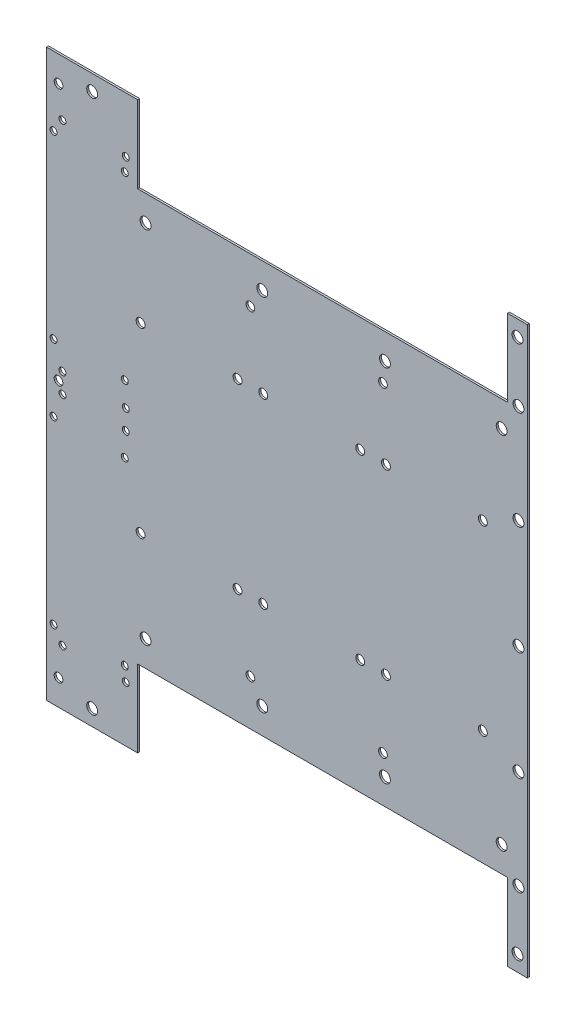
from build123d import *

# Parameters (mm, degrees)
FLOOR_MOUNT_AND_JOINT_HOLES_PROFILE_R   = 2.75
FLOOR_MOUNT_AND_JOINT_HOLES_PROFILE_R_2 = 1.75
FLOOR_MOUNT_AND_JOINT_HOLES_PROFILE_R_3 = 2.25
FLOOR_MOUNT_AND_JOINT_HOLES_PROFILE_R_4 = 2.2
FLOOR_MOUNT_AND_JOINT_HOLES_DEPTH       = 1


with BuildPart() as part:
    # Floor, mount and joint holes profile → Floor, mount and joint holes (new body)
    with BuildSketch(Plane.XY):
        Polygon((-140, -143), (-94, -143), (-94, -104), (93, -104), (93, -143), (103, -143), (103, 143), (93, 143), (93, 104), (-94, 104), (-94, 143), (-140, 143), align=None)
        with Locations((-90, -91)):
            Circle(FLOOR_MOUNT_AND_JOINT_HOLES_PROFILE_R, mode=Mode.SUBTRACT)
        with Locations((-90, 91)):
            Circle(FLOOR_MOUNT_AND_JOINT_HOLES_PROFILE_R, mode=Mode.SUBTRACT)
        with Locations((-31, -91)):
            Circle(FLOOR_MOUNT_AND_JOINT_HOLES_PROFILE_R, mode=Mode.SUBTRACT)
        with Locations((-31, 91)):
            Circle(FLOOR_MOUNT_AND_JOINT_HOLES_PROFILE_R, mode=Mode.SUBTRACT)
        with Locations((31, -91)):
            Circle(FLOOR_MOUNT_AND_JOINT_HOLES_PROFILE_R, mode=Mode.SUBTRACT)
        with Locations((31, 91)):
            Circle(FLOOR_MOUNT_AND_JOINT_HOLES_PROFILE_R, mode=Mode.SUBTRACT)
        with Locations((90, -91)):
            Circle(FLOOR_MOUNT_AND_JOINT_HOLES_PROFILE_R, mode=Mode.SUBTRACT)
        with Locations((90, 91)):
            Circle(FLOOR_MOUNT_AND_JOINT_HOLES_PROFILE_R, mode=Mode.SUBTRACT)
        with Locations((-136.5, -108)):
            Circle(FLOOR_MOUNT_AND_JOINT_HOLES_PROFILE_R_2, mode=Mode.SUBTRACT)
        with Locations((-136.5, -17)):
            Circle(FLOOR_MOUNT_AND_JOINT_HOLES_PROFILE_R_2, mode=Mode.SUBTRACT)
        with Locations((-136.5, 17)):
            Circle(FLOOR_MOUNT_AND_JOINT_HOLES_PROFILE_R_2, mode=Mode.SUBTRACT)
        with Locations((-136.5, 108)):
            Circle(FLOOR_MOUNT_AND_JOINT_HOLES_PROFILE_R_2, mode=Mode.SUBTRACT)
        with Locations((-100.5, -108)):
            Circle(FLOOR_MOUNT_AND_JOINT_HOLES_PROFILE_R_2, mode=Mode.SUBTRACT)
        with Locations((-100.5, -17)):
            Circle(FLOOR_MOUNT_AND_JOINT_HOLES_PROFILE_R_2, mode=Mode.SUBTRACT)
        with Locations((-100.5, 17)):
            Circle(FLOOR_MOUNT_AND_JOINT_HOLES_PROFILE_R_2, mode=Mode.SUBTRACT)
        with Locations((-100.5, 108)):
            Circle(FLOOR_MOUNT_AND_JOINT_HOLES_PROFILE_R_2, mode=Mode.SUBTRACT)
        with Locations((-92.5, -46)):
            Circle(FLOOR_MOUNT_AND_JOINT_HOLES_PROFILE_R_3, mode=Mode.SUBTRACT)
        with Locations((-92.5, 46)):
            Circle(FLOOR_MOUNT_AND_JOINT_HOLES_PROFILE_R_3, mode=Mode.SUBTRACT)
        with Locations((-43.5, -46)):
            Circle(FLOOR_MOUNT_AND_JOINT_HOLES_PROFILE_R_3, mode=Mode.SUBTRACT)
        with Locations((-43.5, 46)):
            Circle(FLOOR_MOUNT_AND_JOINT_HOLES_PROFILE_R_3, mode=Mode.SUBTRACT)
        with Locations((-30.5, -46)):
            Circle(FLOOR_MOUNT_AND_JOINT_HOLES_PROFILE_R_3, mode=Mode.SUBTRACT)
        with Locations((-30.5, 46)):
            Circle(FLOOR_MOUNT_AND_JOINT_HOLES_PROFILE_R_3, mode=Mode.SUBTRACT)
        with Locations((18.5, -46)):
            Circle(FLOOR_MOUNT_AND_JOINT_HOLES_PROFILE_R_3, mode=Mode.SUBTRACT)
        with Locations((18.5, 46)):
            Circle(FLOOR_MOUNT_AND_JOINT_HOLES_PROFILE_R_3, mode=Mode.SUBTRACT)
        with Locations((31.5, -46)):
            Circle(FLOOR_MOUNT_AND_JOINT_HOLES_PROFILE_R_3, mode=Mode.SUBTRACT)
        with Locations((31.5, 46)):
            Circle(FLOOR_MOUNT_AND_JOINT_HOLES_PROFILE_R_3, mode=Mode.SUBTRACT)
        with Locations((80.5, -46)):
            Circle(FLOOR_MOUNT_AND_JOINT_HOLES_PROFILE_R_3, mode=Mode.SUBTRACT)
        with Locations((80.5, 46)):
            Circle(FLOOR_MOUNT_AND_JOINT_HOLES_PROFILE_R_3, mode=Mode.SUBTRACT)
        with Locations((-117, -135)):
            Circle(FLOOR_MOUNT_AND_JOINT_HOLES_PROFILE_R, mode=Mode.SUBTRACT)
        with Locations((-117, 135)):
            Circle(FLOOR_MOUNT_AND_JOINT_HOLES_PROFILE_R, mode=Mode.SUBTRACT)
        with Locations((98, -135)):
            Circle(FLOOR_MOUNT_AND_JOINT_HOLES_PROFILE_R, mode=Mode.SUBTRACT)
        with Locations((98, 135)):
            Circle(FLOOR_MOUNT_AND_JOINT_HOLES_PROFILE_R, mode=Mode.SUBTRACT)
        with Locations((98.5, -105)):
            Circle(FLOOR_MOUNT_AND_JOINT_HOLES_PROFILE_R, mode=Mode.SUBTRACT)
        with Locations((98.5, -55)):
            Circle(FLOOR_MOUNT_AND_JOINT_HOLES_PROFILE_R, mode=Mode.SUBTRACT)
        with Locations((98.5, 0)):
            Circle(FLOOR_MOUNT_AND_JOINT_HOLES_PROFILE_R, mode=Mode.SUBTRACT)
        with Locations((98.5, 55)):
            Circle(FLOOR_MOUNT_AND_JOINT_HOLES_PROFILE_R, mode=Mode.SUBTRACT)
        with Locations((98.5, 105)):
            Circle(FLOOR_MOUNT_AND_JOINT_HOLES_PROFILE_R, mode=Mode.SUBTRACT)
        with Locations((-134, -130)):
            Circle(FLOOR_MOUNT_AND_JOINT_HOLES_PROFILE_R_4, mode=Mode.SUBTRACT)
        with Locations((-134, 0)):
            Circle(FLOOR_MOUNT_AND_JOINT_HOLES_PROFILE_R_4, mode=Mode.SUBTRACT)
        with Locations((-134, 130)):
            Circle(FLOOR_MOUNT_AND_JOINT_HOLES_PROFILE_R_4, mode=Mode.SUBTRACT)
        with Locations((-37, -81)):
            Circle(FLOOR_MOUNT_AND_JOINT_HOLES_PROFILE_R_4, mode=Mode.SUBTRACT)
        with Locations((-37, 81)):
            Circle(FLOOR_MOUNT_AND_JOINT_HOLES_PROFILE_R_4, mode=Mode.SUBTRACT)
        with Locations((30, -81)):
            Circle(FLOOR_MOUNT_AND_JOINT_HOLES_PROFILE_R_4, mode=Mode.SUBTRACT)
        with Locations((30, 81)):
            Circle(FLOOR_MOUNT_AND_JOINT_HOLES_PROFILE_R_4, mode=Mode.SUBTRACT)
        with Locations((-132, -115)):
            Circle(FLOOR_MOUNT_AND_JOINT_HOLES_PROFILE_R_2, mode=Mode.SUBTRACT)
        with Locations((-132, -5)):
            Circle(FLOOR_MOUNT_AND_JOINT_HOLES_PROFILE_R_2, mode=Mode.SUBTRACT)
        with Locations((-132, 5)):
            Circle(FLOOR_MOUNT_AND_JOINT_HOLES_PROFILE_R_2, mode=Mode.SUBTRACT)
        with Locations((-132, 115)):
            Circle(FLOOR_MOUNT_AND_JOINT_HOLES_PROFILE_R_2, mode=Mode.SUBTRACT)
        with Locations((-100, -115)):
            Circle(FLOOR_MOUNT_AND_JOINT_HOLES_PROFILE_R_2, mode=Mode.SUBTRACT)
        with Locations((-100, -5)):
            Circle(FLOOR_MOUNT_AND_JOINT_HOLES_PROFILE_R_2, mode=Mode.SUBTRACT)
        with Locations((-100, 5)):
            Circle(FLOOR_MOUNT_AND_JOINT_HOLES_PROFILE_R_2, mode=Mode.SUBTRACT)
        with Locations((-100, 115)):
            Circle(FLOOR_MOUNT_AND_JOINT_HOLES_PROFILE_R_2, mode=Mode.SUBTRACT)
    extrude(amount=FLOOR_MOUNT_AND_JOINT_HOLES_DEPTH)


solid = part.part
